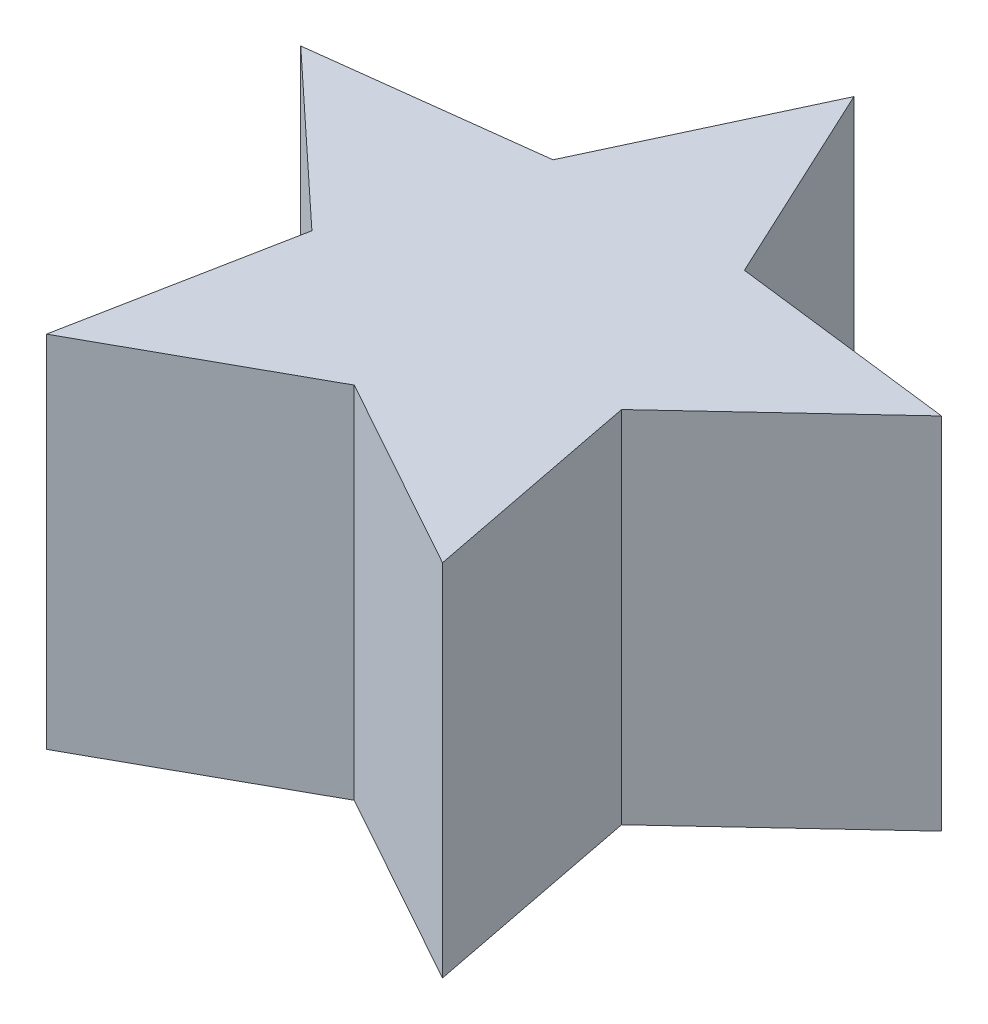
from build123d import *

# Parameters (mm, degrees)
BOSS_EXTRUDE1_DEPTH = 9.5


with BuildPart() as part:
    # Sketch1 → Boss-Extrude1 (new body)
    with BuildSketch(Plane(origin=(0, 0, 0), x_dir=(1, 0, 0), z_dir=(0, 1, 0))):
        Polygon((0, 8.9), (2.527770799, 3.479178027), (8.464402995, 2.75025125), (4.090019069, -1.328927754), (5.231288745, -7.20025125), (0, -4.300500548), (-5.231288745, -7.20025125), (-4.090019069, -1.328927754), (-8.464402995, 2.75025125), (-2.527770799, 3.479178027), align=None)
    extrude(amount=BOSS_EXTRUDE1_DEPTH)


solid = part.part
